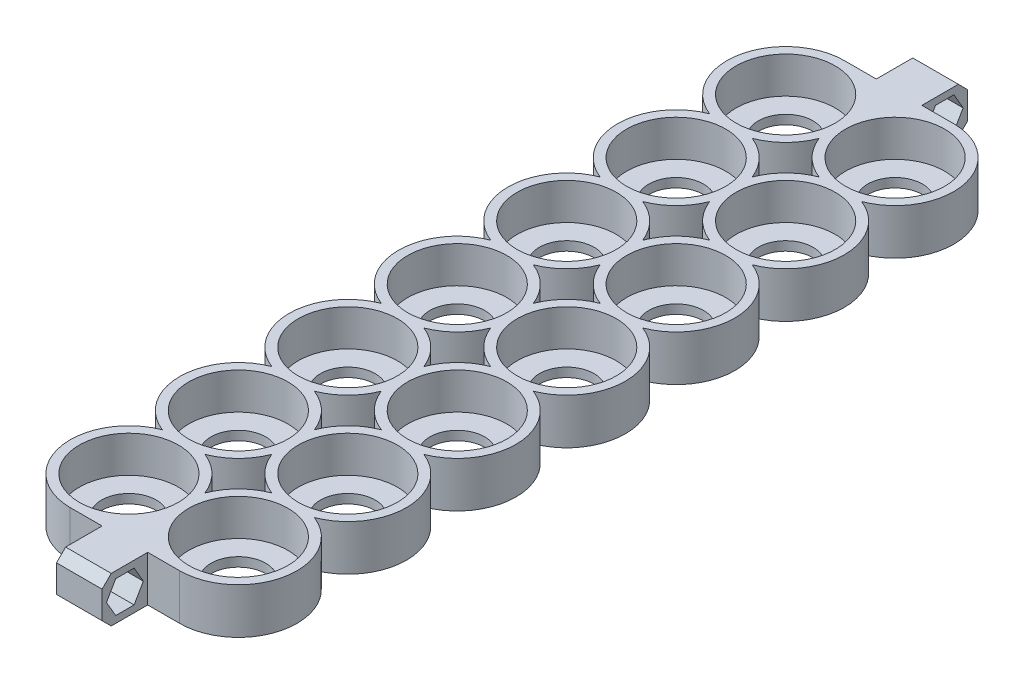
from build123d import *

# Parameters (mm, degrees)
LPATTERN1_COUNT          = 7
LPATTERN1_PITCH          = 24
LPATTERN2_COUNT          = 2
LPATTERN2_PITCH          = 24
BOSS_EXTRUDE1_REACH      = 175.781
SKETCH4_W                = 24
SKETCH4_H                = 10
SKETCH5_W                = 10
SKETCH5_H                = 10
BOSS_EXTRUDE2_DEPTH      = 10
CUT_EXTRUDE1_DEPTH       = 10
CHAMFER3_SIZE            = 2
CHAMFER3_OF_MIRROR2_SIZE = 2


with BuildPart() as part:
    # Sketch1 → Revolve1 (revolve)
    with BuildSketch(Plane(origin=(0, 0, 0), x_dir=(0, 0, -1), z_dir=(1, 0, 0))):
        Polygon((-12.875, 5), (-12.875, -5), (-6, -5), (-6, -3), (-10.875, -3), (-10.875, 5), align=None)
    revolve1 = revolve(axis=Axis((0, 27.077205882, 0), (0, -1, 0)))

    # LPattern1: Revolve1 ×7
    with Locations(*[(0, 0, -i * LPATTERN1_PITCH) for i in range(1, LPATTERN1_COUNT)]):
        add(revolve1)

    # LPattern2: Revolve1 ×2
    with Locations(*[(i * LPATTERN2_PITCH, 0, 0) for i in range(1, LPATTERN2_COUNT)]):
        add(revolve1)

    # LPattern2 copy 1 sketch → LPattern2 copy 1 (revolve)
    with BuildSketch(Plane(origin=(24, 0, -24), x_dir=(0, 0, -1), z_dir=(1, 0, 0))):
        Polygon((-12.875, 5), (-12.875, -5), (-6, -5), (-6, -3), (-10.875, -3), (-10.875, 5), align=None)
    revolve(axis=Axis((24, 27.077205882, -24), (0, -1, 0)))

    # LPattern2 copy 2 sketch → LPattern2 copy 2 (revolve)
    with BuildSketch(Plane(origin=(24, 0, -48), x_dir=(0, 0, -1), z_dir=(1, 0, 0))):
        Polygon((-12.875, 5), (-12.875, -5), (-6, -5), (-6, -3), (-10.875, -3), (-10.875, 5), align=None)
    revolve(axis=Axis((24, 27.077205882, -48), (0, -1, 0)))

    # LPattern2 copy 3 sketch → LPattern2 copy 3 (revolve)
    with BuildSketch(Plane(origin=(24, 0, -72), x_dir=(0, 0, -1), z_dir=(1, 0, 0))):
        Polygon((-12.875, 5), (-12.875, -5), (-6, -5), (-6, -3), (-10.875, -3), (-10.875, 5), align=None)
    revolve(axis=Axis((24, 27.077205882, -72), (0, -1, 0)))

    # LPattern2 copy 4 sketch → LPattern2 copy 4 (revolve)
    with BuildSketch(Plane(origin=(24, 0, -96), x_dir=(0, 0, -1), z_dir=(1, 0, 0))):
        Polygon((-12.875, 5), (-12.875, -5), (-6, -5), (-6, -3), (-10.875, -3), (-10.875, 5), align=None)
    revolve(axis=Axis((24, 27.077205882, -96), (0, -1, 0)))

    # LPattern2 copy 5 sketch → LPattern2 copy 5 (revolve)
    with BuildSketch(Plane(origin=(24, 0, -120), x_dir=(0, 0, -1), z_dir=(1, 0, 0))):
        Polygon((-12.875, 5), (-12.875, -5), (-6, -5), (-6, -3), (-10.875, -3), (-10.875, 5), align=None)
    revolve(axis=Axis((24, 27.077205882, -120), (0, -1, 0)))

    # LPattern2 copy 6 sketch → LPattern2 copy 6 (revolve)
    with BuildSketch(Plane(origin=(24, 0, -144), x_dir=(0, 0, -1), z_dir=(1, 0, 0))):
        Polygon((-12.875, 5), (-12.875, -5), (-6, -5), (-6, -3), (-10.875, -3), (-10.875, 5), align=None)
    revolve(axis=Axis((24, 27.077205882, -144), (0, -1, 0)))

    # Sketch4 → Boss-Extrude1 (add, up to next)
    with BuildSketch(Plane.XY.offset(12.875), mode=Mode.PRIVATE) as boss_extrude1_sk1:
        with Locations((12, 0)):
            Rectangle(SKETCH4_W, SKETCH4_H)
    boss_extrude1_tool1 = extrude(boss_extrude1_sk1.sketch, amount=-BOSS_EXTRUDE1_REACH, mode=Mode.PRIVATE) - part.part
    boss_extrude1 = boss_extrude1_tool1.solids().sort_by_distance((12, 0, 12.875))[0]
    add(boss_extrude1)

    # Sketch5 → Boss-Extrude2 (add)
    with BuildSketch(Plane.XY.offset(12.875)):
        with Locations((12, 0)):
            Rectangle(SKETCH5_W, SKETCH5_H)
    boss_extrude2 = extrude(amount=BOSS_EXTRUDE2_DEPTH)

    # Sketch8 → Cut-Extrude1 (cut)
    with BuildSketch(Plane.ZY.offset(-7)):
        Polygon((19.895725942, -3.5), (21.916451884, 0), (19.895725942, 3.5), (15.854274058, 3.5), (13.833548116, 0), (15.854274058, -3.5), align=None)
    cut_extrude1 = extrude(amount=-CUT_EXTRUDE1_DEPTH, mode=Mode.SUBTRACT)

    # Chamfer3
    chamfer3_edges = [part.edges().sort_by_distance(p)[0] for p in [
        (12, -5, 22.875),
        (12, 5, 22.875),
    ]]
    chamfer(chamfer3_edges, length=CHAMFER3_SIZE)

    # Mirror2: Boss-Extrude1, Boss-Extrude2, Cut-Extrude1 across plane
    add(boss_extrude1.mirror(Plane.XY.offset(-72)))
    add(boss_extrude2.mirror(Plane.XY.offset(-72)))
    add(cut_extrude1.mirror(Plane.XY.offset(-72)), mode=Mode.SUBTRACT)

    # Chamfer3 of Mirror2
    chamfer3_of_mirror2_edges = [part.edges().sort_by_distance(p)[0] for p in [
        (12, -5, -166.875),
        (12, 5, -166.875),
    ]]
    chamfer(chamfer3_of_mirror2_edges, length=CHAMFER3_OF_MIRROR2_SIZE)


solid = part.part
